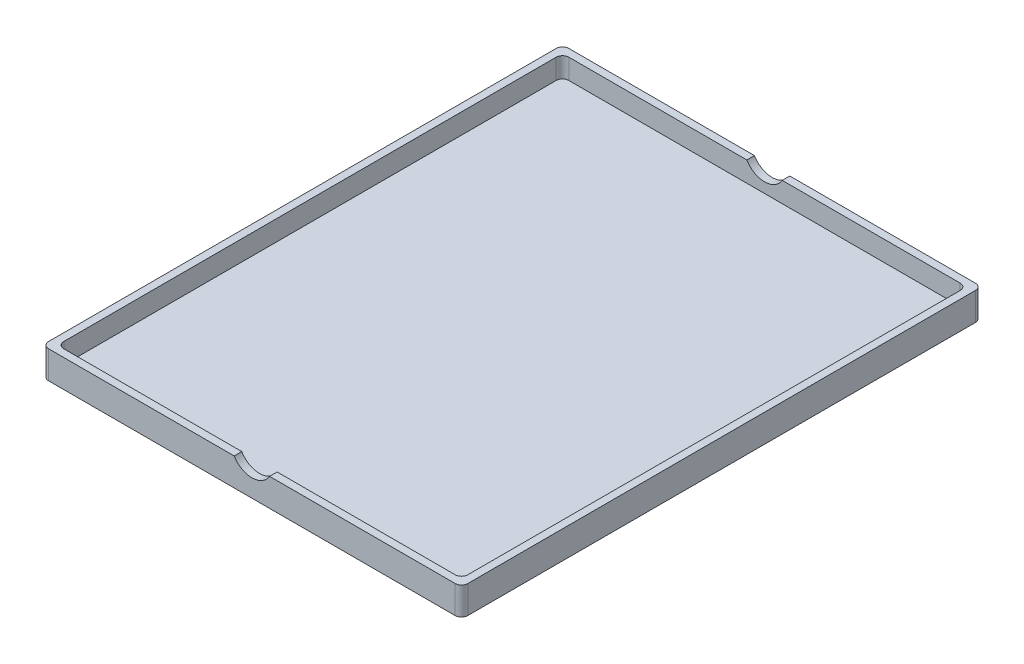
from build123d import *

# Parameters (mm, degrees)
SKETCH1_W           = 160
SKETCH1_H           = 200
BOSS_EXTRUDE1_DEPTH = 8
SHELL1_T            = 3
SKETCH2_W           = 160
SKETCH2_H           = 200
BOSS_EXTRUDE2_DEPTH = 2
FILLET1_R           = 2.5
CUT_EXTRUDE4_DEPTH  = 223.236360661


with BuildPart() as part:
    # Sketch1 → Boss-Extrude1 (new body)
    with BuildSketch(Plane(origin=(0, 0, 0), x_dir=(1, 0, 0), z_dir=(0, 1, 0))):
        Rectangle(SKETCH1_W, SKETCH1_H)
    extrude(amount=BOSS_EXTRUDE1_DEPTH)

    # Shell1
    shell1_openings = [part.faces().sort_by_distance(p)[0] for p in [
        (0, 8, 0),
    ]]
    offset(amount=SHELL1_T, openings=shell1_openings, kind=Kind.INTERSECTION)

    # Sketch2 → Boss-Extrude2 (add)
    with BuildSketch(Plane.XZ.offset(3)):
        Rectangle(SKETCH2_W, SKETCH2_H)
    extrude(amount=BOSS_EXTRUDE2_DEPTH)

    # Fillet1
    fillet1_edges = [part.edges().sort_by_distance(p)[0] for p in [
        (-80, 4, -100),
        (-80, 4, 100),
        (80, 4, 100),
        (80, 4, -100),
        (-80, -4, 100),
        (-80, -4, -100),
        (80, -4, -100),
        (80, -4, 100),
        (-83, 2.5, -103),
        (83, 2.5, -103),
        (83, 2.5, 103),
        (-83, 2.5, 103),
    ]]
    fillet(fillet1_edges, radius=FILLET1_R)

    # Sketch5 → Cut-Extrude4 (cut, through all)
    with BuildSketch(Plane.XY.offset(103)):
        with BuildLine():
            Line((0, 8), (-7, 8))
            ThreePointArc((-7, 8), (0, 4), (7, 8))
            Line((7, 8), (0, 8))
        make_face()
    extrude(amount=-CUT_EXTRUDE4_DEPTH, mode=Mode.SUBTRACT)


solid = part.part
